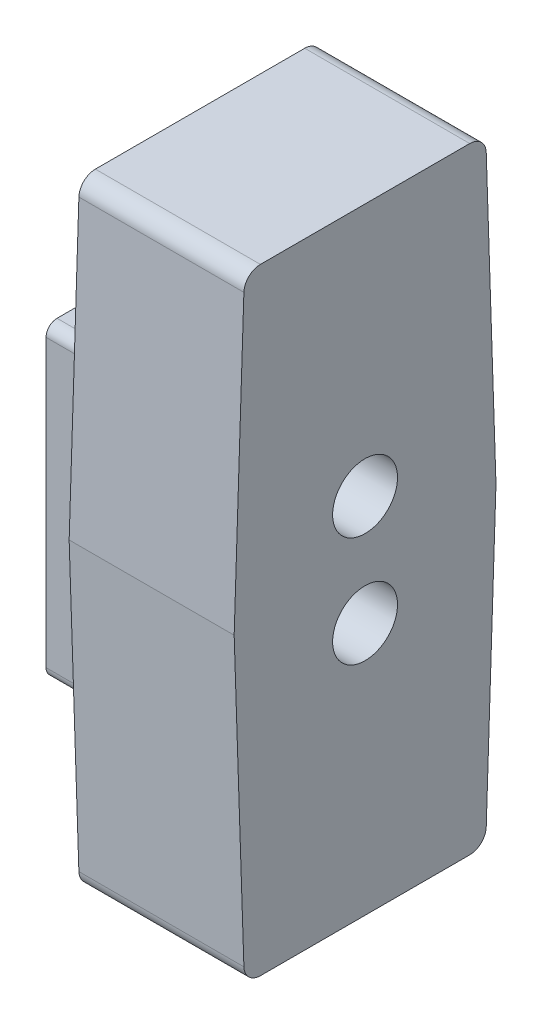
from build123d import *

# Parameters (mm, degrees)
BOSS_EXTRUDE1_DEPTH     = 3.81
BOSS_EXTRUDE2_DEPTH     = 1.016
CUT_EXTRUDE1_DEPTH      = 16.636574662
CUT_EXTRUDE1_DEPTH_BACK = 16.636574662
SKETCH6_R               = 0.75


with BuildPart() as part:
    # Sketch1 → Boss-Extrude1 (new body)
    with BuildSketch(Plane(origin=(0, 0, 0), x_dir=(0, 0, -1), z_dir=(1, 0, 0))):
        with BuildLine():
            Line((0.380788543, -13.474691937), (0.605560313, -6.731))
            Line((0.605560313, -6.731), (0.380788543, 0.012691937))
            ThreePointArc((0.380788543, 0.012691937), (0.2648824, 0.273858201), (0, 0.381))
            Line((0, 0.381), (-4.833515176, 0.381))
            ThreePointArc((-4.833515176, 0.381), (-5.098397576, 0.273858201), (-5.214303719, 0.012691937))
            Line((-5.214303719, 0.012691937), (-5.439075489, -6.731))
            Line((-5.439075489, -6.731), (-5.214303719, -13.474691937))
            ThreePointArc((-5.214303719, -13.474691937), (-5.098397576, -13.735858201), (-4.833515176, -13.843))
            Line((-4.833515176, -13.843), (0, -13.843))
            ThreePointArc((0, -13.843), (0.2648824, -13.735858201), (0.380788543, -13.474691937))
        make_face()
    extrude(amount=BOSS_EXTRUDE1_DEPTH)

    # Sketch5 → Boss-Extrude2 (add)
    with BuildSketch(Plane.ZY):
        with BuildLine():
            Line((0.130757588, -10.287), (4.702757588, -10.287))
            ThreePointArc((4.702757588, -10.287), (4.88236271, -10.212605122), (4.956757588, -10.033))
            Line((4.956757588, -10.033), (4.956757588, -3.429))
            ThreePointArc((4.956757588, -3.429), (4.88236271, -3.249394878), (4.702757588, -3.175))
            Line((4.702757588, -3.175), (0.130757588, -3.175))
            ThreePointArc((0.130757588, -3.175), (-0.048847535, -3.249394878), (-0.123242412, -3.429))
            Line((-0.123242412, -3.429), (-0.123242412, -10.033))
            ThreePointArc((-0.123242412, -10.033), (-0.048847535, -10.212605122), (0.130757588, -10.287))
        make_face()
    extrude(amount=BOSS_EXTRUDE2_DEPTH)

    # Sketch6 → Cut-Extrude1 (cut, two sides: drawn at the far end of the back side and taken through both)
    with BuildSketch(Plane.ZY.offset(1.016).offset(-CUT_EXTRUDE1_DEPTH_BACK)):
        with Locations((2.416757588, -5.461)):
            Circle(SKETCH6_R)
        with Locations((2.416757588, -8.001)):
            Circle(SKETCH6_R)
    extrude(amount=CUT_EXTRUDE1_DEPTH + CUT_EXTRUDE1_DEPTH_BACK, mode=Mode.SUBTRACT)


solid = part.part
